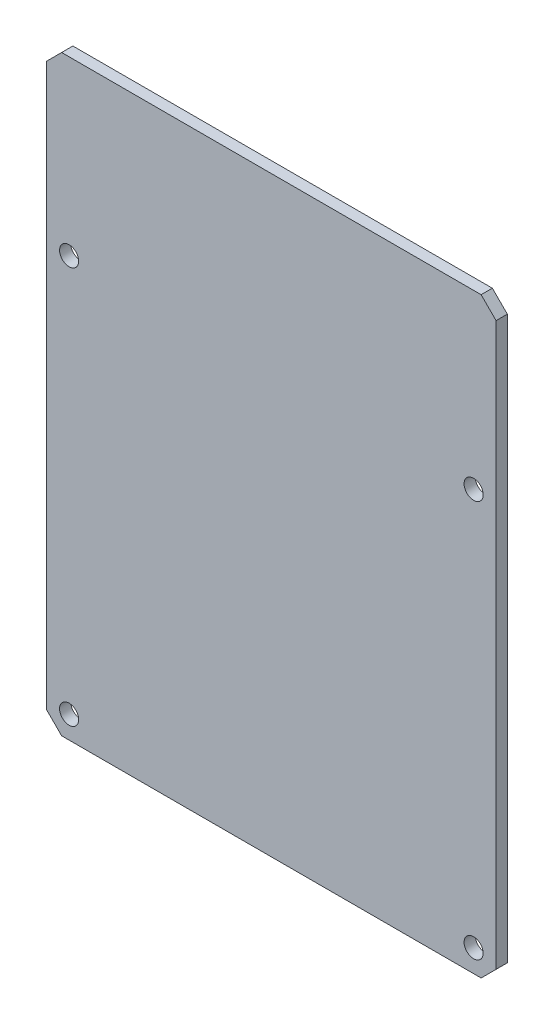
from build123d import *

# Parameters (mm, degrees)
SKETCH_1_W          = 60
SKETCH_1_H          = 79
EXTRUDE_1_DEPTH     = 1.5
CHAMFER_1_SIZE      = 2
HOLE_WIZARD_M2_51_D = 2.55


with BuildPart() as part:
    # Эскиз1 → Бобышка-Вытянуть1 (new body)
    with BuildSketch(Plane.XY):
        Rectangle(SKETCH_1_W, SKETCH_1_H)
    extrude(amount=EXTRUDE_1_DEPTH)

    # Фаска1
    chamfer_1_edges = [part.edges().sort_by_distance(p)[0] for p in [
        (30, -39.5, 0.75),
        (-30, -39.5, 0.75),
        (-30, 39.5, 0.75),
        (30, 39.5, 0.75),
    ]]
    chamfer(chamfer_1_edges, length=CHAMFER_1_SIZE)

    # Сверло под метчик  спиральное M2.51 (through all)
    with Locations(Plane.XY.offset(1.5)):
        with Locations((-27, 16.5), (27, 16.5), (27, -36.5), (-27, -36.5)):
            Hole(HOLE_WIZARD_M2_51_D / 2)


solid = part.part
